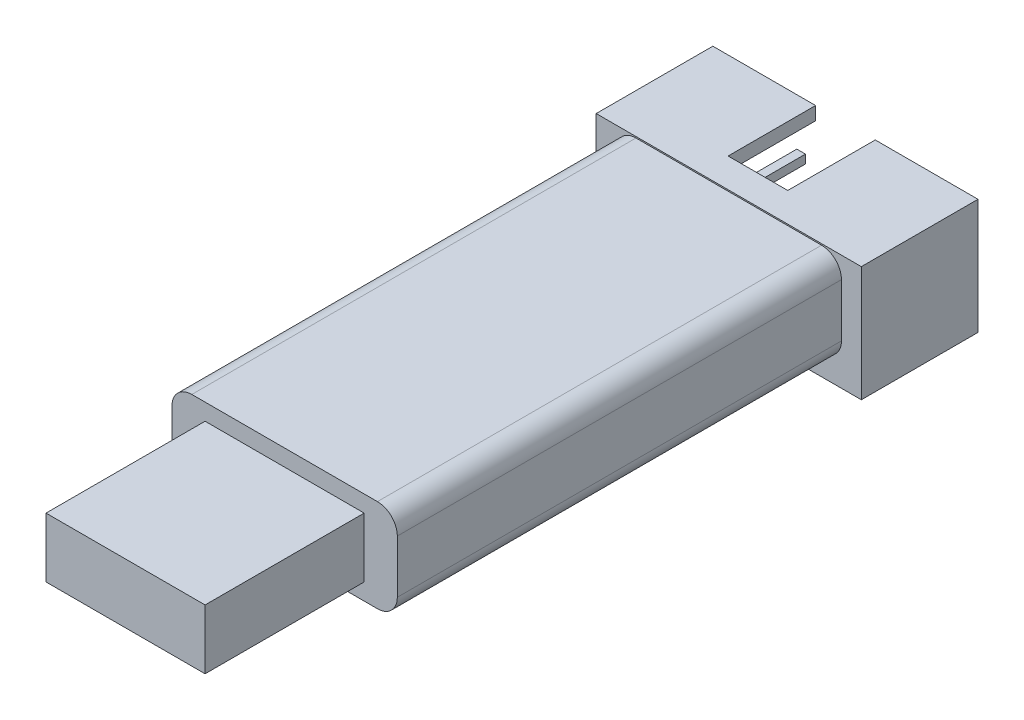
from build123d import *

# Parameters (mm, degrees)
SKETCH1_W           = 12
SKETCH1_H           = 4.5
BOSS_EXTRUDE1_DEPTH = 12
SKETCH2_W           = 17
SKETCH2_H           = 7
BOSS_EXTRUDE2_DEPTH = 33.5
SKETCH3_W           = 20
SKETCH3_H           = 8.7
BOSS_EXTRUDE3_DEPTH = 8.8
SKETCH4_W           = 18
SKETCH4_H           = 6.7
SKETCH4_W_2         = 4.5
SKETCH4_H_2         = 1
CUT_EXTRUDE2_DEPTH  = 6.6
SKETCH5_W           = 0.65
SKETCH5_H           = 0.65
BOSS_EXTRUDE4_DEPTH = 5.8
LPATTERN1_COUNT     = 3
LPATTERN1_PITCH     = 2.54
LPATTERN1_COL_COUNT = 3
LPATTERN1_COL_PITCH = 2.54
FILLET1_R           = 1.5


with BuildPart() as part:
    # Sketch1 → Boss-Extrude1 (new body)
    with BuildSketch(Plane.XY):
        Rectangle(SKETCH1_W, SKETCH1_H)
    extrude(amount=-BOSS_EXTRUDE1_DEPTH)

    # Sketch2 → Boss-Extrude2 (add)
    with BuildSketch(Plane(origin=(0, 0, -12), x_dir=(-1, 0, 0), z_dir=(0, 0, -1))):
        Rectangle(SKETCH2_W, SKETCH2_H)
    extrude(amount=BOSS_EXTRUDE2_DEPTH)

    # Sketch3 → Boss-Extrude3 (add)
    with BuildSketch(Plane(origin=(0, 0, -45.5), x_dir=(-1, 0, 0), z_dir=(0, 0, -1))):
        with Locations((0, -0.75)):
            Rectangle(SKETCH3_W, SKETCH3_H)
    extrude(amount=BOSS_EXTRUDE3_DEPTH)

    # Sketch4 → Cut-Extrude2 (cut)
    with BuildSketch(Plane(origin=(0, 0, -54.3), x_dir=(-1, 0, 0), z_dir=(0, 0, -1))):
        with Locations((0, -0.75)):
            Rectangle(SKETCH4_W, SKETCH4_H)
        with Locations((0, 3.1)):
            Rectangle(SKETCH4_W_2, SKETCH4_H_2)
    extrude(amount=-CUT_EXTRUDE2_DEPTH, mode=Mode.SUBTRACT)

    # Sketch5 → Boss-Extrude4 (add)
    with BuildSketch(Plane(origin=(0, 0, -47.7), x_dir=(-1, 0, 0), z_dir=(0, 0, -1))):
        with Locations((0, 0.52)):
            Rectangle(SKETCH5_W, SKETCH5_H)
        with Locations((0, -2.02)):
            Rectangle(SKETCH5_W, SKETCH5_H)
    boss_extrude4 = extrude(amount=BOSS_EXTRUDE4_DEPTH)

    # LPattern1: Boss-Extrude4 ×3
    with Locations(*[(i * LPATTERN1_PITCH, 0, 0) for i in range(1, LPATTERN1_COUNT)]):
        add(boss_extrude4)

    # LPattern1 col: Boss-Extrude4 ×3
    with Locations(*[(-i * LPATTERN1_COL_PITCH, 0, 0) for i in range(1, LPATTERN1_COL_COUNT)]):
        add(boss_extrude4)

    # Fillet1
    fillet1_edges = [part.edges().sort_by_distance(p)[0] for p in [
        (8.5, 3.5, -28.75),
        (8.5, -3.5, -28.75),
        (-8.5, -3.5, -28.75),
        (-8.5, 3.5, -28.75),
    ]]
    fillet(fillet1_edges, radius=FILLET1_R)


solid = part.part
